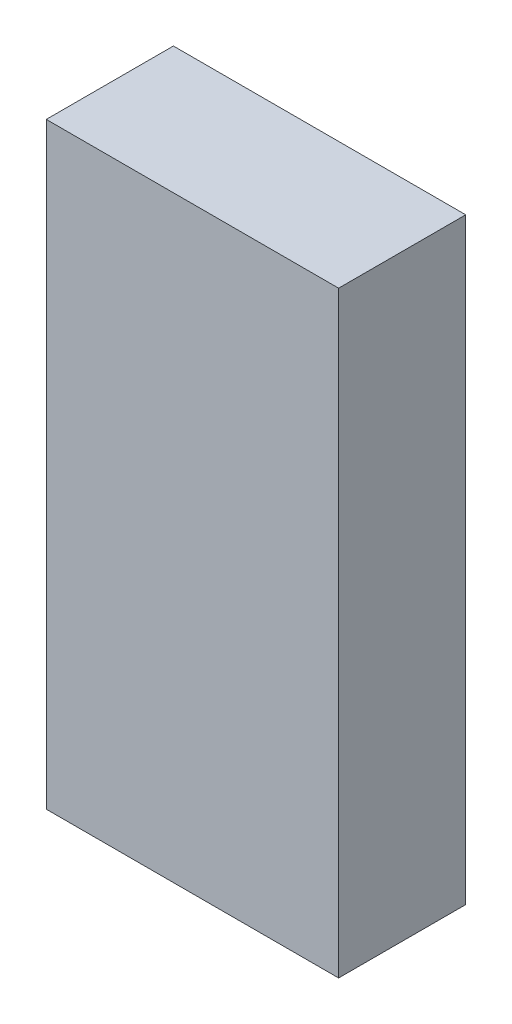
from build123d import *

# Parameters (mm, degrees)
SKETCH1_W           = 115
SKETCH1_H           = 235
BOSS_EXTRUDE1_DEPTH = 50


with BuildPart() as part:
    # Sketch1 → Boss-Extrude1 (new body)
    with BuildSketch(Plane.XY):
        Rectangle(SKETCH1_W, SKETCH1_H)
    extrude(amount=BOSS_EXTRUDE1_DEPTH)


solid = part.part
